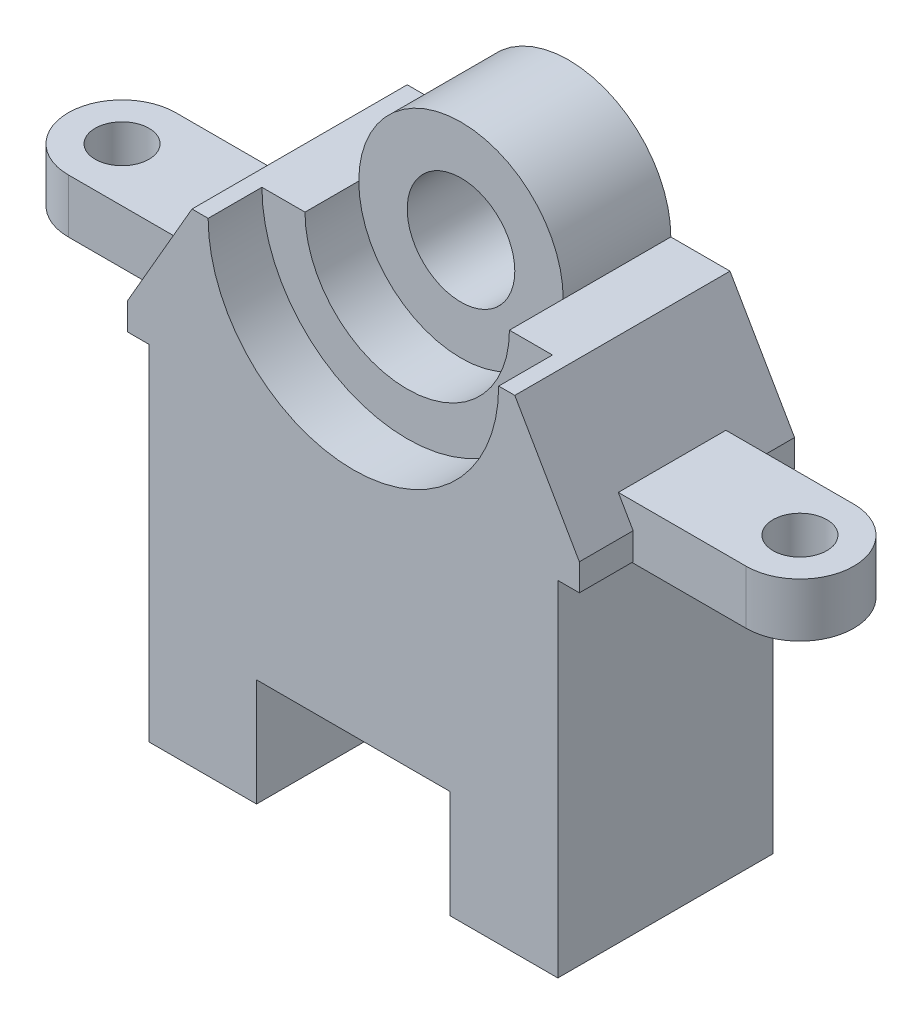
from build123d import *

# Parameters (mm, degrees)
BOSS_EXTRUDE1_DEPTH = 20
SKETCH2_W           = 36
SKETCH2_H           = 20
CUT_EXTRUDE1_DEPTH  = 107.88908334
CUT_EXTRUDE3_DEPTH  = 10
CUT_EXTRUDE5_DEPTH  = 10
SKETCH6_R           = 19
SKETCH6_R_2         = 10
BOSS_EXTRUDE2_DEPTH = 20
CUT_EXTRUDE6_DEPTH  = 102.120107483
BOSS_EXTRUDE3_START = -26
BOSS_EXTRUDE3_DEPTH = 10
SKETCH9_R           = 5
CUT_EXTRUDE7_DEPTH  = 106.703210108


with BuildPart() as part:
    # Sketch1 → Boss-Extrude1 (new, symmetric)
    with BuildSketch(Plane.XY):
        Polygon((38, -89.784609691), (38, -25.784609691), (42, -25.784609691), (42, -20.784609691), (30, 0), (-30, 0), (-42, -20.784609691), (-42, -25.784609691), (-38, -25.784609691), (-38, -89.784609691), align=None)
    extrude(amount=BOSS_EXTRUDE1_DEPTH, both=True)

    # Sketch2 → Cut-Extrude1 (cut, through all)
    with BuildSketch(Plane.XY.offset(20)):
        with Locations((0, -79.784609691)):
            Rectangle(SKETCH2_W, SKETCH2_H)
    extrude(amount=-CUT_EXTRUDE1_DEPTH, mode=Mode.SUBTRACT)

    # Sketch3 → Cut-Extrude3 (cut)
    with BuildSketch(Plane.XY.offset(20)):
        with BuildLine():
            Line((-27, 0), (27, 0))
            ThreePointArc((27, 0), (0, -27), (-27, 0))
        make_face()
    extrude(amount=-CUT_EXTRUDE3_DEPTH, mode=Mode.SUBTRACT)

    # Sketch5 → Cut-Extrude5 (cut)
    with BuildSketch(Plane.XY.offset(10)):
        with BuildLine():
            Line((-19, 0), (19, 0))
            ThreePointArc((19, 0), (0, -19), (-19, 0))
        make_face()
    extrude(amount=-CUT_EXTRUDE5_DEPTH, mode=Mode.SUBTRACT)

    # Sketch6 → Boss-Extrude2 (add)
    with BuildSketch(Plane.XY):
        Circle(SKETCH6_R)
        Circle(SKETCH6_R_2, mode=Mode.SUBTRACT)
    extrude(amount=-BOSS_EXTRUDE2_DEPTH)

    # Sketch6<2> → Cut-Extrude6 (cut, through all)
    with BuildSketch(Plane.XY):
        with BuildLine():
            Line((-10, 0), (10, 0))
            ThreePointArc((10, 0), (0, 10), (-10, 0))
        make_face()
        with BuildLine():
            ThreePointArc((-10, 0), (0, -10), (10, 0))
            Line((10, 0), (-10, 0))
        make_face()
    extrude(amount=-CUT_EXTRUDE6_DEPTH, mode=Mode.SUBTRACT)

    # Sketch8 → Boss-Extrude3 (add)
    with BuildSketch(Plane(origin=(0, 0, 0), x_dir=(1, 0, 0), z_dir=(0, 1, 0)).offset(BOSS_EXTRUDE3_START)):
        with BuildLine():
            Line((63, 10), (27, 10))
            Line((27, 10), (27, -10))
            Line((27, -10), (63, -10))
            ThreePointArc((63, -10), (73, 0), (63, 10))
        make_face()
    boss_extrude3 = extrude(amount=BOSS_EXTRUDE3_DEPTH)

    # Mirror1: Boss-Extrude3 across plane
    add(boss_extrude3.mirror(Plane(origin=(0, 0, 0), x_dir=(0, 0, 1), z_dir=(1, 0, 0))))

    # Sketch9 → Cut-Extrude7 (cut, through all)
    with BuildSketch(Plane(origin=(0, -16, 0), x_dir=(1, 0, 0), z_dir=(0, 1, 0))):
        with Locations(Location((-63, 0, 0), (0, 0, 270))):
            Circle(SKETCH9_R)
    cut_extrude7 = extrude(amount=-CUT_EXTRUDE7_DEPTH, mode=Mode.SUBTRACT)

    # Mirror2: Cut-Extrude7 across plane
    add(cut_extrude7.mirror(Plane(origin=(0, 0, 0), x_dir=(0, 0, 1), z_dir=(1, 0, 0))), mode=Mode.SUBTRACT)


solid = part.part
